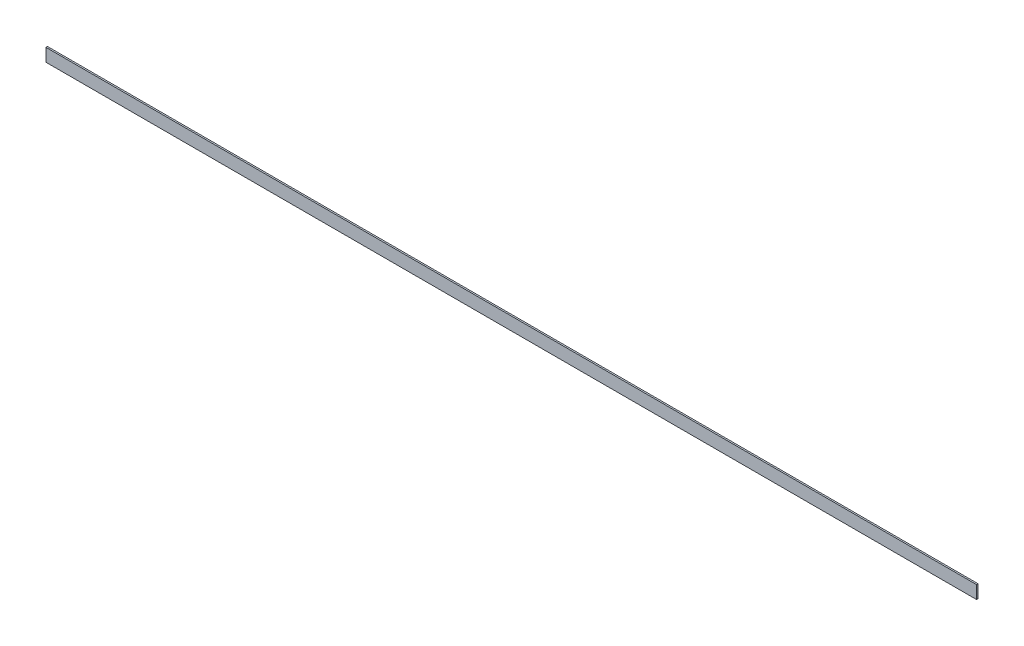
from build123d import *

# Parameters (mm, degrees)
ESQUISSE1_W        = 971.05190865
ESQUISSE1_H        = 13.5
BOSS_EXTRU_1_DEPTH = 1.5875


with BuildPart() as part:
    # Esquisse1 → Boss.-Extru.1 (new body)
    with BuildSketch(Plane.XY):
        with Locations((-13.577916333, 229.732117487)):
            Rectangle(ESQUISSE1_W, ESQUISSE1_H)
    extrude(amount=BOSS_EXTRU_1_DEPTH)


solid = part.part
